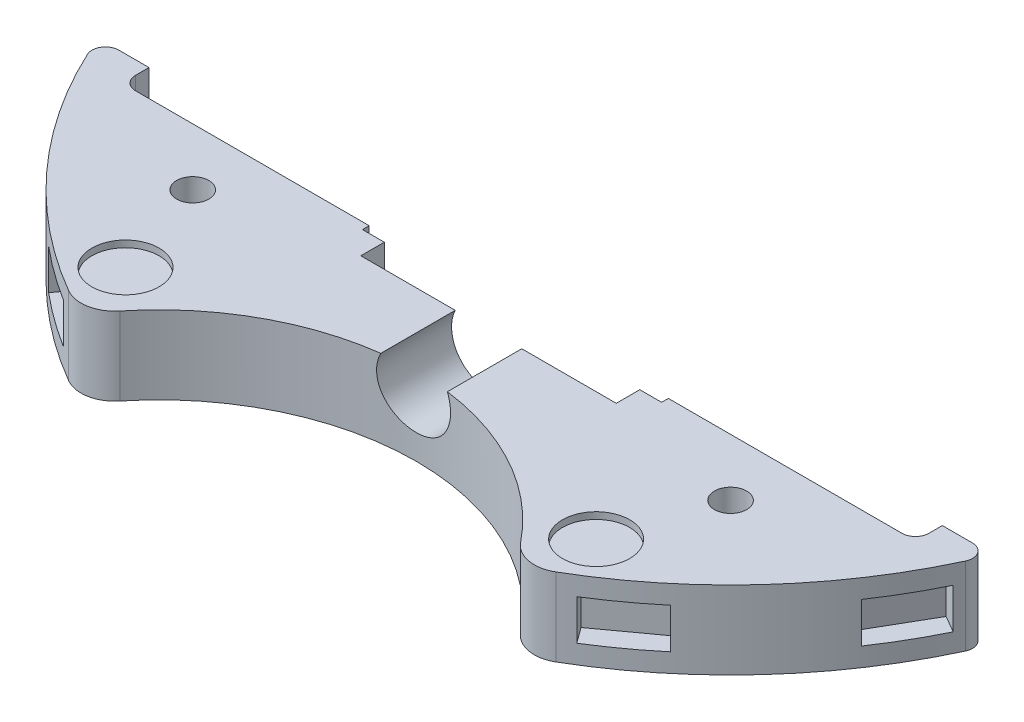
from build123d import *

# Parameters (mm, degrees)
BOSS_EXTRUDE1_DEPTH  = 5.8
SOLENOID_PLACEMENT_W = 38
SOLENOID_PLACEMENT_H = 64
CUT_EXTRUDE1_DEPTH   = 103.481998419
SKETCH6_R            = 2.4
CUT_EXTRUDE6_DEPTH   = 103.481998419
CUT_EXTRUDE3_DEPTH   = 103.481998419
FILLET1_R            = 2
CUT_EXTRUDE7_DEPTH   = 3
SKETCH11_R           = 5.5
CUT_EXTRUDE8_DEPTH   = 72.028583754
SKETCH12_W           = 44.5
SKETCH12_H           = 65
CUT_EXTRUDE9_DEPTH   = 92.53668667
SKETCH13_R           = 5
CUT_EXTRUDE10_DEPTH  = 1


with BuildPart() as part:
    # Sketch1 → Boss-Extrude1 (new, symmetric)
    with BuildSketch(Plane(origin=(0, 0, 0), x_dir=(1, 0, 0), z_dir=(0, 1, 0))):
        with BuildLine():
            ThreePointArc((36.224522061, -62.223661106), (0, 72), (-36.224522061, -62.223661106))
            ThreePointArc((-36.224522061, -62.223661106), (-32.797800029, -62.818856853), (-29.811944095, -61.035223988))
            ThreePointArc((-29.811944095, -61.035223988), (0, -46.75), (29.811944095, -61.035223988))
            ThreePointArc((29.811944095, -61.035223988), (32.797800029, -62.818856853), (36.224522061, -62.223661106))
        make_face()
    extrude(amount=BOSS_EXTRUDE1_DEPTH, both=True)

    # solenoid placement → Cut-Extrude1 (cut, through all)
    with BuildSketch(Plane(origin=(0, 5.8, 0), x_dir=(1, 0, 0), z_dir=(0, 1, 0))):
        with Locations((0, -4)):
            Rectangle(SOLENOID_PLACEMENT_W, SOLENOID_PLACEMENT_H)
    extrude(amount=-CUT_EXTRUDE1_DEPTH, mode=Mode.SUBTRACT)

    # Sketch6 → Cut-Extrude6 (cut, through all)
    with BuildSketch(Plane(origin=(0, 5.8, 0), x_dir=(1, 0, 0), z_dir=(0, 1, 0))):
        with Locations(Location((40, -40, 0), (0, 0, 90))):
            Circle(SKETCH6_R)
        with Locations(Location((-40, -40, 0), (0, 0, 270))):
            Circle(SKETCH6_R)
    extrude(amount=-CUT_EXTRUDE6_DEPTH, mode=Mode.SUBTRACT)

    # Sketch3 → Cut-Extrude3 (cut, through all)
    with BuildSketch(Plane(origin=(0, 5.8, 0), x_dir=(1, 0, 0), z_dir=(0, 1, 0))):
        Polygon((-72, -27.5), (-59, -27.5), (-59, -31.5), (59, -31.5), (59, -27.5), (72, -27.5), (72, 31.5), (72, 72), (-72, 72), (-72, 31.5), align=None)
    extrude(amount=-CUT_EXTRUDE3_DEPTH, mode=Mode.SUBTRACT)

    # Fillet1
    fillet1_edges = [part.edges().sort_by_distance(p)[0] for p in [
        (66.541340534, 0, 27.5),
        (-66.541340534, 0, 27.5),
        (59, 0, 31.5),
        (-59, 0, 31.5),
    ]]
    fillet(fillet1_edges, radius=FILLET1_R)

    # Sketch9 → Cut-Extrude7 (cut, symmetric)
    with BuildSketch(Plane(origin=(0, 0, 0), x_dir=(1, 0, 0), z_dir=(0, 1, 0))):
        with BuildLine():
            Line((-64.703295733, -31.582962517), (-62.191822062, -30.132962517))
            Line((-62.191822062, -30.132962517), (-57.191822062, -38.793216555))
            Line((-57.191822062, -38.793216555), (-59.703295733, -40.243216555))
            ThreePointArc((-59.703295733, -40.243216555), (-62.353829072, -36), (-64.703295733, -31.582962517))
        make_face()
        with BuildLine():
            Line((-46.263453759, -55.169673248), (-44.558876527, -52.823523965))
            Line((-44.558876527, -52.823523965), (-36.468706583, -58.701376488))
            Line((-36.468706583, -58.701376488), (-38.173283815, -61.047525771))
            ThreePointArc((-38.173283815, -61.047525771), (-42.320538165, -58.249223595), (-46.263453759, -55.169673248))
        make_face()
        with BuildLine():
            Line((38.173283815, -61.047525771), (36.468706583, -58.701376488))
            Line((36.468706583, -58.701376488), (44.558876527, -52.823523965))
            Line((44.558876527, -52.823523965), (46.263453759, -55.169673248))
            ThreePointArc((46.263453759, -55.169673248), (42.320538165, -58.249223595), (38.173283815, -61.047525771))
        make_face()
        with BuildLine():
            Line((59.703295733, -40.243216555), (57.191822062, -38.793216555))
            Line((57.191822062, -38.793216555), (62.191822062, -30.132962517))
            Line((62.191822062, -30.132962517), (64.703295733, -31.582962517))
            ThreePointArc((64.703295733, -31.582962517), (62.353829072, -36), (59.703295733, -40.243216555))
        make_face()
    extrude(amount=CUT_EXTRUDE7_DEPTH, both=True, mode=Mode.SUBTRACT)

    # Sketch11 → Cut-Extrude8 (cut, through all)
    with BuildSketch(Plane(origin=(0, 0, 36), x_dir=(-1, 0, 0), z_dir=(0, 0, -1))):
        with Locations((0, 3.4)):
            Circle(SKETCH11_R)
    extrude(amount=-CUT_EXTRUDE8_DEPTH, mode=Mode.SUBTRACT)

    # Sketch12 → Cut-Extrude9 (cut, through all)
    with BuildSketch(Plane(origin=(0, 5.8, 0), x_dir=(1, 0, 0), z_dir=(0, 1, 0))):
        Rectangle(SKETCH12_W, SKETCH12_H)
    extrude(amount=-CUT_EXTRUDE9_DEPTH, mode=Mode.SUBTRACT)

    # Sketch13 → Cut-Extrude10 (cut)
    with BuildSketch(Plane(origin=(0, 5.8, 0), x_dir=(1, 0, 0), z_dir=(0, 1, 0))):
        with Locations(Location((-35, -55, 0), (0, 0, 270))):
            Circle(SKETCH13_R)
        with Locations(Location((35, -55, 0), (0, 0, 90))):
            Circle(SKETCH13_R)
    extrude(amount=-CUT_EXTRUDE10_DEPTH, mode=Mode.SUBTRACT)


solid = part.part
